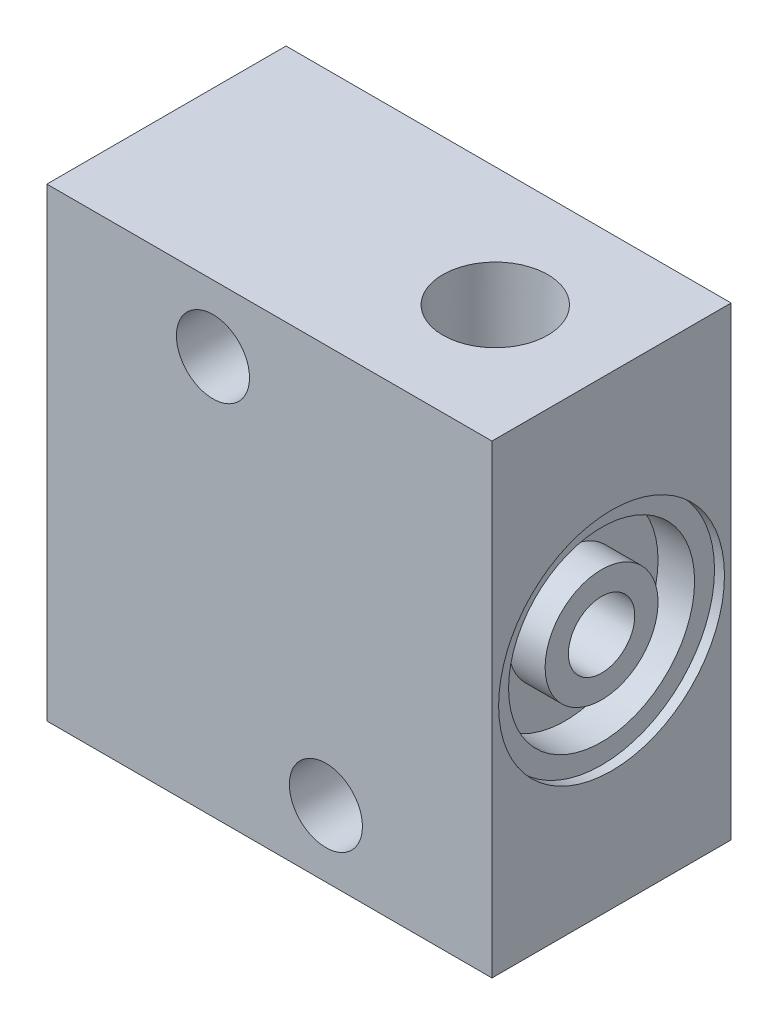
from build123d import *

# Parameters (mm, degrees)
ESQUISSE1_W                                   = 67
ESQUISSE1_H                                   = 70
BASE_EXTRUSION_DEPTH                          = 18
ESQUISSE8_R                                   = 2.851179932
ENL_V_MAT_EXTRU_1_DEPTH                       = 29
ESQUISSE9_R                                   = 5.5
TROUS_DE_PASSAGE_POUR_FIXATIONMAT_EXTRU_DEPTH = 84.725742756
R_P_TITION_LIN_AIRE1_COUNT                    = 2
R_P_TITION_LIN_AIRE1_PITCH                    = 15
R_P_TITION_LIN_AIRE1_COUNT_DIR2               = 2
R_P_TITION_LIN_AIRE1_PITCH_DIR2               = 50


with BuildPart() as part:
    # Esquisse1 → Base-Extrusion (new, symmetric)
    with BuildSketch(Plane.XY):
        with Locations((33.5, 0)):
            Rectangle(ESQUISSE1_W, ESQUISSE1_H)
    extrude(amount=BASE_EXTRUSION_DEPTH, both=True)

    # Esquisse2 → Enlèvement de matière-Révolution1 (revolve, cut)
    with BuildSketch(Plane.XY, mode=Mode.PRIVATE) as enl_vement_de_mati_re_r_volution1_sk:
        with BuildLine():
            Line((0, 12.5), (12.5, 12.5))
            Line((12.5, 12.5), (12.5, 10))
            Line((12.5, 10), (11.75, 10))
            ThreePointArc((11.75, 10), (11, 9.25), (11.75, 8.5))
            Line((11.75, 8.5), (12.25, 8.5))
            Line((12.25, 8.5), (12.75, 8))
            Line((12.75, 8), (20.5, 8))
            Line((20.5, 8), (21.5, 9))
            Line((21.5, 9), (28.5, 9))
            Line((28.5, 9), (29.5, 8))
            Line((29.5, 8), (45, 8))
            Line((45, 8), (45, 12))
            Line((45, 12), (54, 12))
            Line((54, 12), (54, 8))
            Line((54, 8), (54, 5))
            Line((54, 5), (65.5, 5))
            Line((65.5, 5), (65.5, 8.5))
            Line((65.5, 8.5), (60, 8.5))
            Line((60, 8.5), (60, 14))
            Line((60, 14), (65.5, 14))
            Line((65.5, 14), (65.5, 17))
            Line((65.5, 17), (67, 17))
            Line((67, 17), (67, 0))
            Line((67, 0), (0, 0))
            Line((0, 0), (0, 12.5))
        make_face()
    revolve(enl_vement_de_mati_re_r_volution1_sk.sketch.rotate(Axis((-4.441074665, 0, 0), (1, 0, 0)), 90), axis=Axis((-4.441074665, 0, 0), (1, 0, 0)), mode=Mode.SUBTRACT)

    # Esquisse4 → Filetage de tuyauterie ISO 7 - Rc 3/81 (revolve, cut)
    with BuildSketch(Plane(origin=(49.5, 35, 0), x_dir=(0, 0, 1), z_dir=(1, 0, 0))):
        Polygon((0, 0), (0, 26.296153426), (7.15, 22), (7.15, 20), (7.278667579, 20), (7.903, 0), align=None)
    revolve(axis=Axis((49.5, 41.35, 0), (0, -1, 0)), mode=Mode.SUBTRACT)

    # Esquisse7 → Perçage1 (revolve, cut)
    with BuildSketch(Plane(origin=(25, -35, 0), x_dir=(0, 0, -1), z_dir=(1, 0, 0))):
        Polygon((0, 0), (0, 26.296153426), (7.15, 22), (7.15, 20), (7.278667579, 20), (7.903, 0), align=None)
    revolve(axis=Axis((25, -41.35, 0), (0, 1, 0)), mode=Mode.SUBTRACT)

    # Esquisse8 → Enlèv. mat.-Extru.1 (cut)
    with BuildSketch(Plane.XZ.offset(35)):
        with Locations(Location((25, 0, 0), (0, 0, 270))):
            Circle(ESQUISSE8_R)
    extrude(amount=-ENL_V_MAT_EXTRU_1_DEPTH, mode=Mode.SUBTRACT)

    # Esquisse9 → Trous de passage pour fixationmat.-Extru.2 (cut, through all)
    with BuildSketch(Plane.XY.offset(18)):
        with Locations((25, 25)):
            Circle(ESQUISSE9_R)
        with Locations((42, -25)):
            Circle(ESQUISSE9_R)
    extrude(amount=-TROUS_DE_PASSAGE_POUR_FIXATIONMAT_EXTRU_DEPTH, mode=Mode.SUBTRACT)

    # Esquisse10 → Trou taraudé M5x0.81 (revolve, cut)
    with BuildSketch(Plane(origin=(0, 25, 7.5), x_dir=(0, 0, 1), z_dir=(0, 1, 0))):
        Polygon((0, 0), (0, 15.2618073), (2.1, 14), (2.1, 0), align=None)
    trou_taraud_m5x0_81 = revolve(axis=Axis((-6.35, 25, 7.5), (1, 0, 0)), mode=Mode.SUBTRACT)

    # Répétition linéaire1: Trou taraud_ M5x0.81 2 × 2
    with Locations(*[(0, -j * R_P_TITION_LIN_AIRE1_PITCH_DIR2, -i * R_P_TITION_LIN_AIRE1_PITCH) for i in range(R_P_TITION_LIN_AIRE1_COUNT) for j in range(R_P_TITION_LIN_AIRE1_COUNT_DIR2) if (i, j) != (0, 0)]):
        add(trou_taraud_m5x0_81, mode=Mode.SUBTRACT)

    # Esquisse12 → Trou taraudé M5x0.82 (revolve, cut)
    with BuildSketch(Plane(origin=(54, -35, -7.5), x_dir=(0, 0, -1), z_dir=(1, 0, 0))):
        Polygon((0, 0), (0, 19.2618073), (2.1, 18), (2.1, 0), align=None)
    trou_taraud_m5x0_82 = revolve(axis=Axis((54, -41.35, -7.5), (0, 1, 0)), mode=Mode.SUBTRACT)

    # Symétrie1: Trou taraudé M5x0.82 across plane
    add(trou_taraud_m5x0_82.mirror(Plane.XY), mode=Mode.SUBTRACT)


solid = part.part
